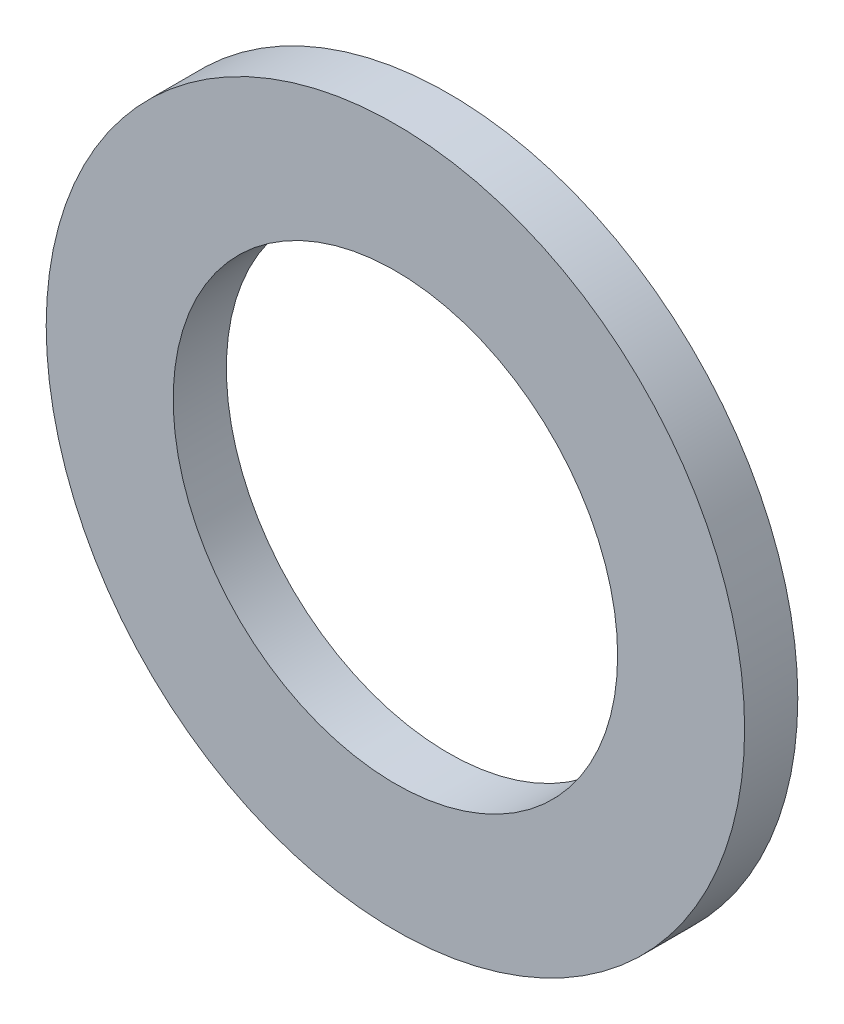
from build123d import *

# Parameters (mm, degrees)
SKETCH1_R           = 22
SKETCH1_R_2         = 14
EXTRUDE_THIN2_DEPTH = 3.35


with BuildPart() as part:
    # Sketch1 → Extrude-Thin2 (new body)
    with BuildSketch(Plane.XY):
        Circle(SKETCH1_R)
        Circle(SKETCH1_R_2, mode=Mode.SUBTRACT)
    extrude(amount=EXTRUDE_THIN2_DEPTH)


solid = part.part
